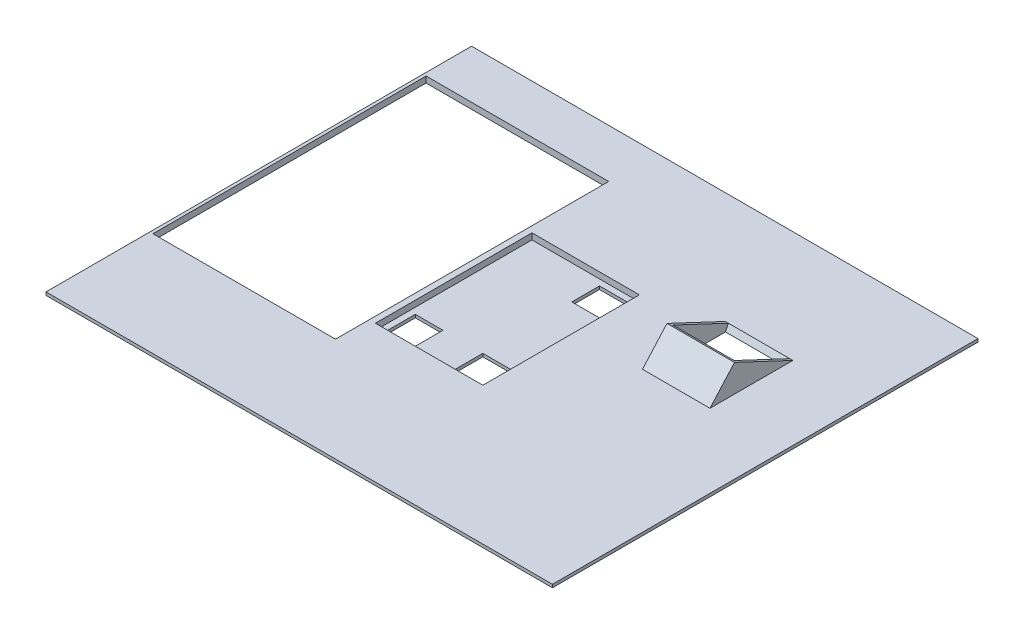
from build123d import *

# Parameters (mm, degrees)
SKETCH1_W               = 167
SKETCH1_H               = 140.66
BOSS_EXTRUDE1_DEPTH     = 2
BOSS_EXTRUDE1_DRAFT     = -45
CUT_EXTRUDE1_REACH      = 220.353
SKETCH2_W               = 167
SKETCH2_H               = 140.66
SKETCH2_W_2             = 165
SKETCH2_H_2             = 138.66
BOSS_EXTRUDE2_START     = 120
BOSS_EXTRUDE2_DEPTH     = 22
CUT_EXTRUDE2_REACH      = 211.584
SKETCH4_W               = 20
SKETCH4_H               = 20
CUT_EXTRUDE3_DEPTH      = 218.119588246
CUT_EXTRUDE3_DEPTH_BACK = 218.119588246
SKETCH5_W               = 9
SKETCH5_H               = 9
CUT_EXTRUDE4_REACH      = 219.12
SKETCH6_W               = 59.5
SKETCH6_H               = 89
SKETCH7_W               = 35
SKETCH7_H               = 51
CUT_EXTRUDE5_DEPTH      = 2
BOSS_EXTRUDE4_START     = -2
SKETCH11_W              = 39
SKETCH11_H              = 55
BOSS_EXTRUDE4_DEPTH     = 1
CUT_EXTRUDE6_DEPTH      = 218.119588246
CUT_EXTRUDE6_DEPTH_BACK = 218.119588246
SKETCH12_W              = 9
SKETCH12_H              = 9


with BuildPart() as part:
    # Sketch1 → Boss-Extrude1 (with draft: the straight prism first)
    with BuildSketch(Plane(origin=(0, 0, 0), x_dir=(1, 0, 0), z_dir=(0, 1, 0))):
        with Locations((83.5, 70.33)):
            Rectangle(SKETCH1_W, SKETCH1_H)
    extrude(amount=-BOSS_EXTRUDE1_DEPTH)
    # Boss-Extrude1: the draft: its side faces are tilted about the plane it starts from
    boss_extrude1_sides = [part.faces().sort_by_distance(p)[0] for p in [
        (83.5, -1, 0),
        (167, -1, -70.33),
        (83.5, -1, -140.66),
        (0, -1, -70.33),
    ]]
    draft(boss_extrude1_sides, Plane(origin=(0, 0, 0), x_dir=(1, 0, 0), z_dir=(0, 1, 0)), BOSS_EXTRUDE1_DRAFT)

    # Sketch2 → Cut-Extrude1 (cut, up to next)
    with BuildSketch(Plane.XZ.offset(2), mode=Mode.PRIVATE) as cut_extrude1_sk1:
        with Locations((83.5, -70.33)):
            Rectangle(SKETCH2_W, SKETCH2_H)
        with Locations((83.5, -70.33)):
            Rectangle(SKETCH2_W_2, SKETCH2_H_2, mode=Mode.SUBTRACT)
    cut_extrude1_tool1 = extrude(cut_extrude1_sk1.sketch, amount=-CUT_EXTRUDE1_REACH, mode=Mode.PRIVATE) & part.part
    add(cut_extrude1_tool1.solids().sort_by_distance((83.5, -2, -140.441656))[0], mode=Mode.SUBTRACT)

    # Sketch3 → Boss-Extrude2 (add)
    with BuildSketch(Plane(origin=(0, 0, 0), x_dir=(0, 0, -1), z_dir=(1, 0, 0)).offset(BOSS_EXTRUDE2_START)):
        Polygon((76.33, 0), (84.33, 8.94427191), (103.33, 0), align=None)
    extrude(amount=BOSS_EXTRUDE2_DEPTH)

    # Cut-Extrude2: up to this plane
    cut_extrude2_end = Plane(origin=(0, -2, 0), z_dir=(0, -1, 0))
    # Sketch4 → Cut-Extrude2 (cut, up to the surface)
    with BuildSketch(Plane(origin=(0, 39.818641072, -18.744671202), x_dir=(1, 0, 0), z_dir=(0, 0.9047619047619048, -0.42591770999996015)), mode=Mode.PRIVATE) as cut_extrude2_sk1:
        with Locations((131, 83.489047619)):
            Rectangle(SKETCH4_W, SKETCH4_H)
    cut_extrude2_tool1 = split(extrude(cut_extrude2_sk1.sketch, amount=-CUT_EXTRUDE2_REACH, mode=Mode.PRIVATE), bisect_by=cut_extrude2_end, keep=Keep.BOTH, mode=Mode.PRIVATE)
    add(cut_extrude2_tool1.solids().sort_by_distance((131, 4.259177, -94.282381))[0], mode=Mode.SUBTRACT)

    # Sketch5 → Cut-Extrude3 (cut, two sides: drawn at the far end of the back side and taken through both)
    with BuildSketch(Plane(origin=(0, 0, 0), x_dir=(1, 0, 0), z_dir=(0, 1, 0)).offset(-CUT_EXTRUDE3_DEPTH_BACK)):
        with Locations((92, 90.33)):
            Rectangle(SKETCH5_W, SKETCH5_H)
        with Locations((92, 52.33)):
            Rectangle(SKETCH5_W, SKETCH5_H)
        with Locations((70, 52.33)):
            Rectangle(SKETCH5_W, SKETCH5_H)
    extrude(amount=CUT_EXTRUDE3_DEPTH + CUT_EXTRUDE3_DEPTH_BACK, mode=Mode.SUBTRACT)

    # Sketch6 → Cut-Extrude4 (cut, up to next)
    with BuildSketch(Plane(origin=(0, 0, 0), x_dir=(1, 0, 0), z_dir=(0, 1, 0)), mode=Mode.PRIVATE) as cut_extrude4_sk1:
        with Locations((31.75, 79.33)):
            Rectangle(SKETCH6_W, SKETCH6_H)
    cut_extrude4_tool1 = extrude(cut_extrude4_sk1.sketch, amount=-CUT_EXTRUDE4_REACH, mode=Mode.PRIVATE) & part.part
    add(cut_extrude4_tool1.solids().sort_by_distance((31.75, 0, -79.33))[0], mode=Mode.SUBTRACT)

    # Sketch7 → Cut-Extrude5 (cut)
    with BuildSketch(Plane(origin=(0, 0, 0), x_dir=(1, 0, 0), z_dir=(0, 1, 0))):
        with Locations((81, 71.33)):
            Rectangle(SKETCH7_W, SKETCH7_H)
    extrude(amount=-CUT_EXTRUDE5_DEPTH, mode=Mode.SUBTRACT)

    # Sketch11 → Boss-Extrude4 (add)
    with BuildSketch(Plane(origin=(0, 0, 0), x_dir=(1, 0, 0), z_dir=(0, 1, 0)).offset(BOSS_EXTRUDE4_START)):
        with Locations((81, 71.33)):
            Rectangle(SKETCH11_W, SKETCH11_H)
    extrude(amount=-BOSS_EXTRUDE4_DEPTH)

    # Sketch12 → Cut-Extrude6 (cut, two sides: drawn at the far end of the back side and taken through both)
    with BuildSketch(Plane(origin=(0, 0, 0), x_dir=(1, 0, 0), z_dir=(0, 1, 0)).offset(-CUT_EXTRUDE6_DEPTH_BACK)):
        with Locations((92, 52.33)):
            Rectangle(SKETCH12_W, SKETCH12_H)
        with Locations((70, 52.33)):
            Rectangle(SKETCH12_W, SKETCH12_H)
        with Locations((92, 90.33)):
            Rectangle(SKETCH12_W, SKETCH12_H)
    extrude(amount=CUT_EXTRUDE6_DEPTH + CUT_EXTRUDE6_DEPTH_BACK, mode=Mode.SUBTRACT)


solid = part.part
